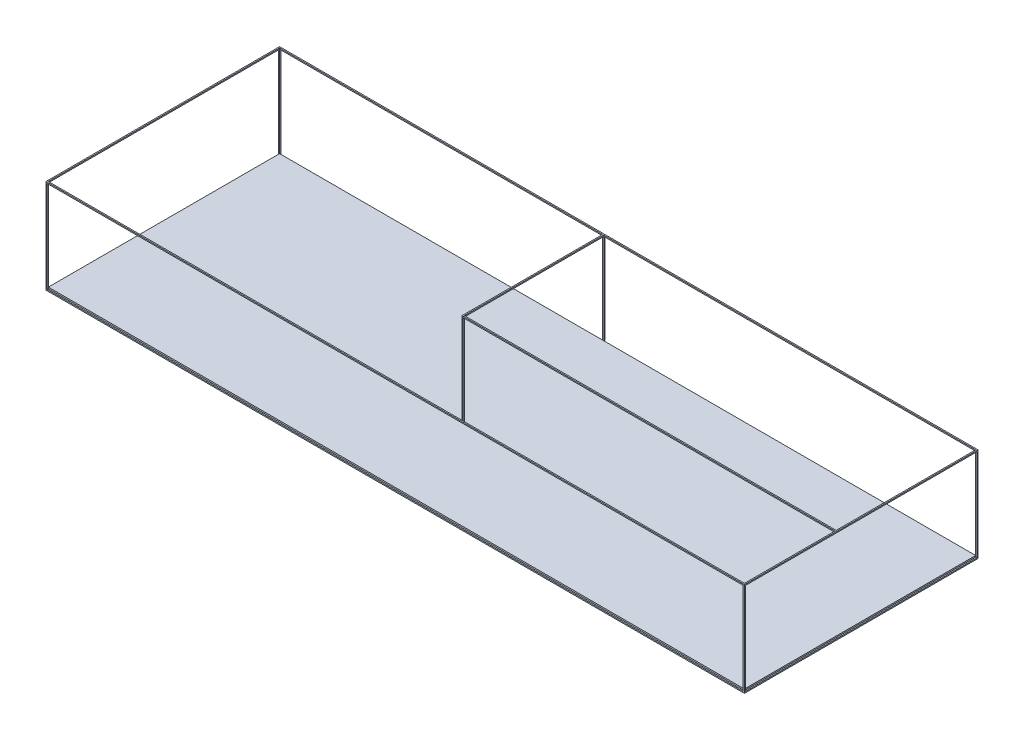
from build123d import *

# Parameters (mm, degrees)
CROQUIS2_W              = 25.4
CROQUIS2_H              = 25.4
CROQUIS3_W              = 25.4
CROQUIS3_H              = 25.4
SALIENTE_EXTRUIR1_DEPTH = 2000
CROQUIS4_W              = 25.4
CROQUIS4_H              = 25.4
SALIENTE_EXTRUIR2_DEPTH = 4993
CROQUIS5_W              = 25.4
CROQUIS5_H              = 25.4
SALIENTE_EXTRUIR3_DEPTH = 14977
SALIENTE_EXTRUIR5_REACH = 8178.587
CROQUIS9_W              = 3000
CROQUIS9_H              = 2000
CORTAR_EXTRUIR2_DEPTH   = 3769
CORTAR_EXTRUIR3_DEPTH   = 1551
CROQUIS12_W             = 14974.6
CROQUIS12_H             = 4974.6
SALIENTE_EXTRUIR7_DEPTH = 57
CROQUIS13_W             = 25.205134762
CROQUIS13_H             = 25.4
SALIENTE_EXTRUIR8_DEPTH = 1950


with BuildPart() as part:
    # Barrer1: sweep along a path in Croquis1
    with BuildLine(Plane(origin=(0, 0, 0), x_dir=(1, 0, 0), z_dir=(0, 1, 0))) as barrer1_path:
        Line((-7500, -2500), (7500, -2500))
        Line((7500, -2500), (7500, 2500))
        Line((7500, 2500), (-7500, 2500))
        Line((-7500, 2500), (-7500, -2500))
    # Croquis2 → Barrer1 (sweep)
    with BuildSketch(Plane(origin=(0, 0, 0), x_dir=(0, 0, -1), z_dir=(1, 0, 0))):
        with Locations((-2500, 0)):
            Rectangle(CROQUIS2_W, CROQUIS2_H)
    sweep(path=barrer1_path.line, transition=Transition.RIGHT)

    # Croquis3 → Saliente-Extruir1 (add)
    with BuildSketch(Plane(origin=(0, 12.7, 0), x_dir=(1, 0, 0), z_dir=(0, 1, 0))):
        with Locations((-7500, 2500)):
            Rectangle(CROQUIS3_W, CROQUIS3_H)
        with Locations((-7500, -2500)):
            Rectangle(CROQUIS3_W, CROQUIS3_H)
        with Locations((7500, -2500)):
            Rectangle(CROQUIS3_W, CROQUIS3_H)
        with Locations((7500, 2500)):
            Rectangle(CROQUIS3_W, CROQUIS3_H)
    extrude(amount=SALIENTE_EXTRUIR1_DEPTH)

    # Croquis4 → Saliente-Extruir2 (add)
    with BuildSketch(Plane.XY.offset(-2487.3)):
        with Locations((-7500, 2000)):
            Rectangle(CROQUIS4_W, CROQUIS4_H)
    saliente_extruir2 = extrude(amount=SALIENTE_EXTRUIR2_DEPTH)

    # Simetría1: Saliente-Extruir2 across plane
    add(saliente_extruir2.mirror(Plane(origin=(0, 0, 0), x_dir=(0, 0, 1), z_dir=(1, 0, 0))))

    # Croquis5 → Saliente-Extruir3 (add)
    with BuildSketch(Plane.ZY.offset(-7487.3)):
        with Locations((2500, 2000)):
            Rectangle(CROQUIS5_W, CROQUIS5_H)
        with Locations((-2500, 2000)):
            Rectangle(CROQUIS5_W, CROQUIS5_H)
    extrude(amount=SALIENTE_EXTRUIR3_DEPTH)

    # Saliente-Extruir5: up to this face of the body (flat: up to its plane)
    saliente_extruir5_end = Plane(part.part.faces().sort_by_distance((0, -12.7, 2496.856474814))[0])
    # Croquis8 → Saliente-Extruir5 (add, up to the picked face)
    with BuildSketch(Plane(origin=(0, 2012.7, 0), x_dir=(1, 0, 0), z_dir=(0, 1, 0)), mode=Mode.PRIVATE) as saliente_extruir5_sk1:
        Polygon((-512.7, 2487.3), (-512.7, -512.7), (7487.3, -512.7), (7487.3, -538.1), (-538.1, -538.1), (-538.1, 2487.3), align=None)
    saliente_extruir5_tool1 = split(extrude(saliente_extruir5_sk1.sketch, amount=-SALIENTE_EXTRUIR5_REACH, mode=Mode.PRIVATE), bisect_by=saliente_extruir5_end, keep=Keep.BOTH, mode=Mode.PRIVATE)
    add(saliente_extruir5_tool1.solids().sort_by(Axis((-521.276718, 2012.7, -987.3), (0, -1, 0)))[0])

    # Croquis9 → Cortar-Extruir2 (cut)
    with BuildSketch(Plane.ZY.offset(538.1)):
        with Locations((-987.3, 987.3)):
            Rectangle(CROQUIS9_W, CROQUIS9_H)
    extrude(amount=-CORTAR_EXTRUIR2_DEPTH, mode=Mode.SUBTRACT)

    # Croquis11 → Cortar-Extruir3 (cut)
    with BuildSketch(Plane.XY.offset(538.1)):
        Polygon((-512.7, 1987.3), (-512.7, 12.7), (-512.7, -12.7), (7487.3, -12.7), (7487.3, 1987.3), align=None)
    extrude(amount=-CORTAR_EXTRUIR3_DEPTH, mode=Mode.SUBTRACT)

    # Croquis13 → Saliente-Extruir8 (add)
    with BuildSketch(Plane.XZ.offset(-1987.3)):
        with Locations((-525.302567381, -2500)):
            Rectangle(CROQUIS13_W, CROQUIS13_H)
    extrude(amount=SALIENTE_EXTRUIR8_DEPTH)


with BuildPart() as body_2:
    # Croquis12 → Saliente-Extruir7 (new body)
    with BuildSketch(Plane.XZ.offset(12.7)):
        Rectangle(CROQUIS12_W, CROQUIS12_H)
    extrude(amount=-SALIENTE_EXTRUIR7_DEPTH)


solid = Compound([part.part, body_2.part])
